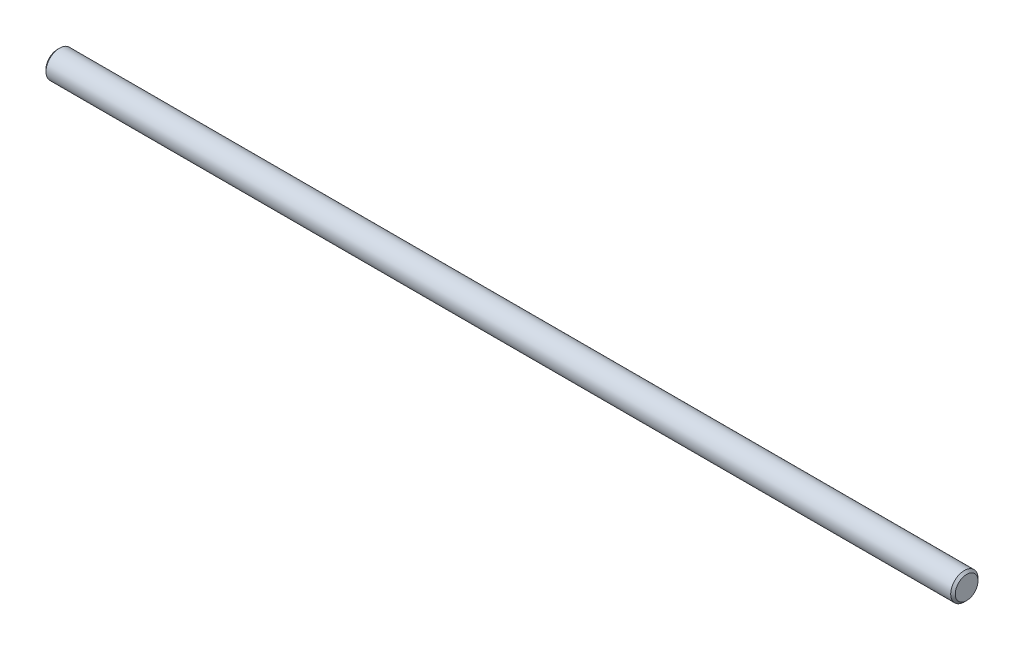
from build123d import *

# Parameters (mm, degrees)
SKETCH1_R           = 6
BOSS_EXTRUDE1_DEPTH = 400
CHAMFER1_SIZE       = 1


with BuildPart() as part:
    # Sketch1 → Boss-Extrude1 (new body)
    with BuildSketch(Plane(origin=(0, 0, 0), x_dir=(0, 0, -1), z_dir=(1, 0, 0))):
        Circle(SKETCH1_R)
    extrude(amount=BOSS_EXTRUDE1_DEPTH)

    # Chamfer1
    chamfer1_edges = [part.edges().sort_by_distance(p)[0] for p in [
        (0, 0, 6),
        (400, 0, 6),
    ]]
    chamfer(chamfer1_edges, length=CHAMFER1_SIZE)


solid = part.part
